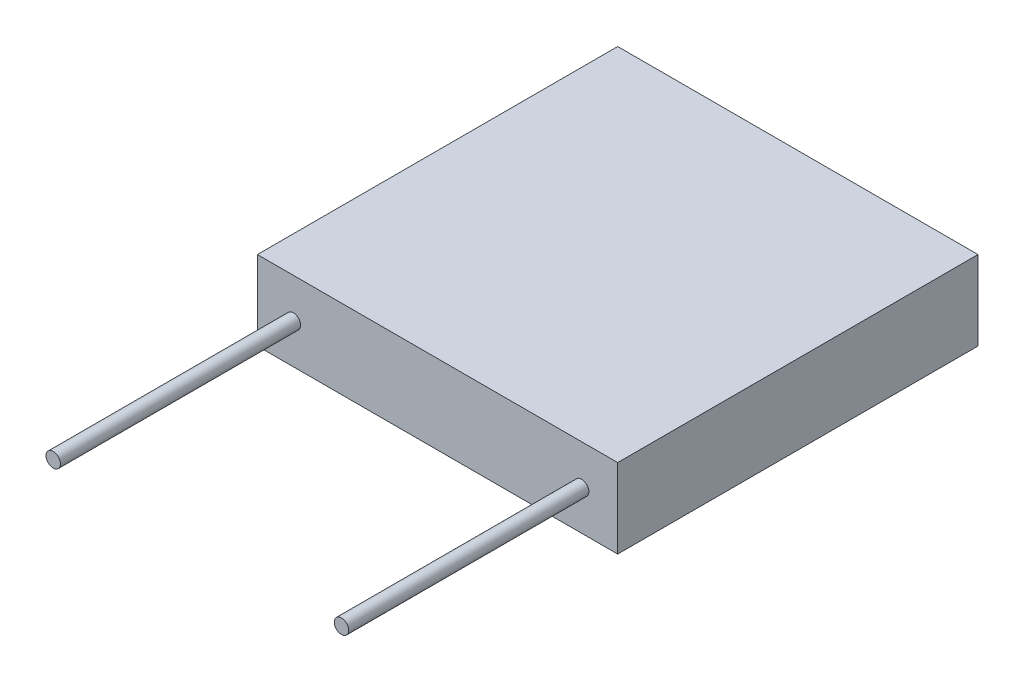
from build123d import *

# Parameters (mm, degrees)
SKETCH_1_W      = 15
SKETCH_1_H      = 15
EXTRUDE_1_DEPTH = 3.3
SKETCH_2_R      = 0.3
EXTRUDE_2_DEPTH = 10


with BuildPart() as part:
    # 草图1 → 拉伸1 (new body)
    with BuildSketch(Plane(origin=(0, 0, 0), x_dir=(1, 0, 0), z_dir=(0, 1, 0))):
        Rectangle(SKETCH_1_W, SKETCH_1_H)
    extrude(amount=EXTRUDE_1_DEPTH)

    # 草图2 → 拉伸2 (add)
    with BuildSketch(Plane.XY.offset(7.5)):
        with Locations(Location((-6, 1.65, 0), (0, 0, 180))):
            Circle(SKETCH_2_R)
        with Locations(Location((6, 1.65, 0), (0, 0, 180))):
            Circle(SKETCH_2_R)
    extrude(amount=EXTRUDE_2_DEPTH)


solid = part.part
